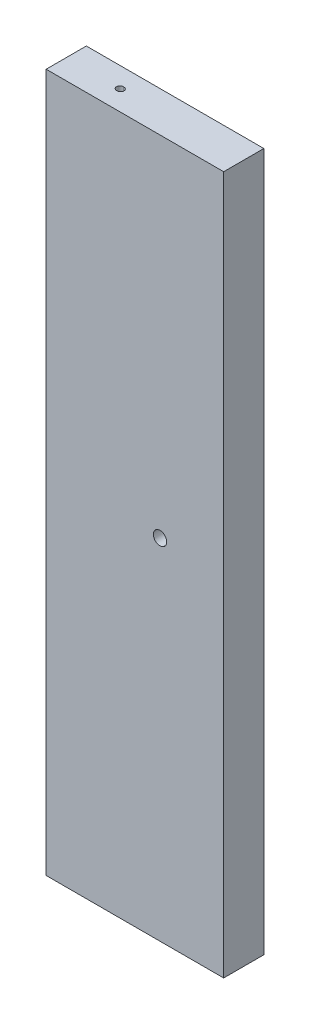
from build123d import *

# Parameters (mm, degrees)
SKETCH1_W                   = 84.137862113
SKETCH1_H                   = 330.949999988
BOSS_EXTRUDE1_DEPTH         = 19.05
HOLE1_D                     = 3.175
HOLE1_DEPTH                 = 31.75
HOLE1_CSINK_D               = 10.16
HOLE1_CSINK_ANGLE           = 82
HOLE1_TIP                   = 0.953866233
HOLE3_D                     = 3.175
HOLE3_DEPTH                 = 38.1
HOLE3_CSINK_D               = 10.16
HOLE3_CSINK_ANGLE           = 82
HOLE3_TIP                   = 0.953866233
F_1_4_0_25_DIAMETER_HOLE1_D = 6.35
HOLE4_D                     = 3.175
HOLE4_DEPTH                 = 31.75
HOLE4_CSINK_D               = 10.16
HOLE4_CSINK_ANGLE           = 82
HOLE4_TIP                   = 0.953866233
HOLE5_D                     = 3.175
HOLE5_DEPTH                 = 38.1
HOLE5_CSINK_D               = 10.16
HOLE5_CSINK_ANGLE           = 82
HOLE5_TIP                   = 0.953866233


with BuildPart() as part:
    # Sketch1 → Boss-Extrude1 (new body)
    with BuildSketch(Plane.XY):
        with Locations((251.421898238, -72.024999997)):
            Rectangle(SKETCH1_W, SKETCH1_H)
    extrude(amount=BOSS_EXTRUDE1_DEPTH)

    # Hole1
    with Locations(Plane(origin=(196.652967181, -72.024999997, 386.262770337), x_dir=(0, 1, 0), z_dir=(-1, 0, 0))):
        with Locations((174.999999994, 685.961004241), (174.999999994, 549.837259632), (174.999999994, 413.713515022), (81.549999997, 779.649723129), (81.549999997, 652.344645962), (62.499999997, 662.953402392), (62.499999997, 769.040966698), (-62.499999997, 769.040966698), (-62.499999997, 662.953402392), (-81.549999997, 652.344645962), (-81.549999997, 779.649723129), (-174.999999994, 413.713515022), (-174.999999994, 549.837259632), (-174.999999994, 685.961004241), (-82.737499997, 600.384620239), (0, 600.384620239), (82.737499997, 600.384620239), (0, 376.737770337), (-82.737499997, 376.737770337), (82.737499997, 376.737770337)):
            CounterSinkHole(HOLE1_D / 2, HOLE1_CSINK_D / 2, depth=HOLE1_DEPTH, counter_sink_angle=HOLE1_CSINK_ANGLE)
            with Locations((0, 0, -(HOLE1_DEPTH + HOLE1_TIP / 2))):  # 118° drill point
                Cone(0, HOLE1_D / 2, HOLE1_TIP, mode=Mode.SUBTRACT)

    # Hole3
    with Locations(Plane(origin=(-181.039434513, 112.499999997, 386.262770337), x_dir=(0.9271838545667855, -1.3196841813264566e-15, -0.37460659341591657), z_dir=(0, 1, 0))):
        with Locations((46.221112845, 113.488854888), (39.39759596, 37.945520226), (412.28786892, 80.423559293), (407.308516105, 25.297013484), (513.561319184, 161.164706775), (597.46020397, 127.267357003), (610.543339245, 159.649253123), (694.322923815, 367.011001477), (526.644454459, 193.546602895), (610.424039029, 400.908351249)):
            CounterSinkHole(HOLE3_D / 2, HOLE3_CSINK_D / 2, depth=HOLE3_DEPTH, counter_sink_angle=HOLE3_CSINK_ANGLE)
            with Locations((0, 0, -(HOLE3_DEPTH + HOLE3_TIP / 2))):  # 118° drill point
                Cone(0, HOLE3_D / 2, HOLE3_TIP, mode=Mode.SUBTRACT)

    # 1/4 (0.25) Diameter Hole1 (through all)
    with Locations(Plane(origin=(0, 0, 0), x_dir=(-1, 0, 0), z_dir=(0, 0, -1))):
        with Locations((-263.328329294, -72.024999997)):
            Hole(F_1_4_0_25_DIAMETER_HOLE1_D / 2)

    # Hole4
    with Locations(Plane(origin=(196.652967181, -72.024999997, 609.90962024), x_dir=(0, 1, 0), z_dir=(-1, 0, 0))):
        with Locations((174.999999994, 685.961004241), (174.999999994, 549.837259632), (174.999999994, 413.713515022), (81.549999997, 779.649723129), (81.549999997, 652.344645962), (62.499999997, 662.953402392), (62.499999997, 769.040966698), (-62.499999997, 769.040966698), (-62.499999997, 662.953402392), (-81.549999997, 652.344645962), (-81.549999997, 779.649723129), (-174.999999994, 413.713515022), (-174.999999994, 549.837259632), (-174.999999994, 685.961004241), (-82.737499997, 600.384620239), (0, 600.384620239), (82.737499997, 600.384620239), (0, 376.737770337), (-82.737499997, 376.737770337), (82.737499997, 376.737770337)):
            CounterSinkHole(HOLE4_D / 2, HOLE4_CSINK_D / 2, depth=HOLE4_DEPTH, counter_sink_angle=HOLE4_CSINK_ANGLE)
            with Locations((0, 0, -(HOLE4_DEPTH + HOLE4_TIP / 2))):  # 118° drill point
                Cone(0, HOLE4_D / 2, HOLE4_TIP, mode=Mode.SUBTRACT)

    # Hole5
    with Locations(Plane(origin=(-181.039434513, 112.499999997, 609.90962024), x_dir=(0.9271838545667913, -6.190403823971236e-15, -0.3746065934159023), z_dir=(0, 1, 0))):
        with Locations((46.221112845, 113.488854888), (39.39759596, 37.945520226), (412.28786892, 80.423559293), (407.308516105, 25.297013484), (513.561319184, 161.164706775), (597.46020397, 127.267357003), (610.413630265, 158.37956732), (694.652415845, 366.877878057), (526.881492954, 193.157790175), (610.762859894, 400.771458735)):
            CounterSinkHole(HOLE5_D / 2, HOLE5_CSINK_D / 2, depth=HOLE5_DEPTH, counter_sink_angle=HOLE5_CSINK_ANGLE)
            with Locations((0, 0, -(HOLE5_DEPTH + HOLE5_TIP / 2))):  # 118° drill point
                Cone(0, HOLE5_D / 2, HOLE5_TIP, mode=Mode.SUBTRACT)


solid = part.part
